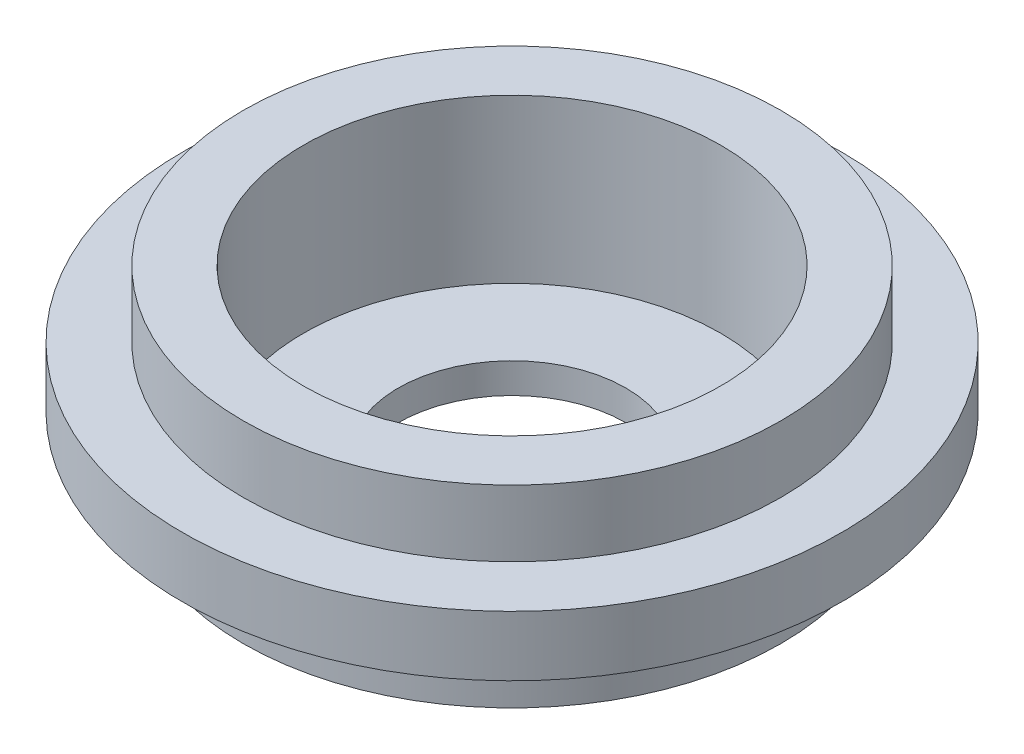
from build123d import *


with BuildPart() as part:
    # Profile Sketch → Profile Revolve (revolve)
    with BuildSketch(Plane(origin=(0, 0, 0), x_dir=(0, 0, -1), z_dir=(1, 0, 0)), mode=Mode.PRIVATE) as profile_revolve_sk:
        Polygon((-6, -3.499999985), (-6, -5.087499985), (-11, -5.087499985), (-14.175, -5.087499985), (-14.175, -1.585), (-17.375, -1.585), (-17.375, 1.585), (-14.175, 1.585), (-14.175, 5.087499985), (-11, 5.087499985), (-11, -3.499999985), align=None)
    revolve(profile_revolve_sk.sketch.rotate(Axis((0, -5.087499985, 0), (0, 1, 0)), 180), axis=Axis((0, -5.087499985, 0), (0, 1, 0)))


solid = part.part
